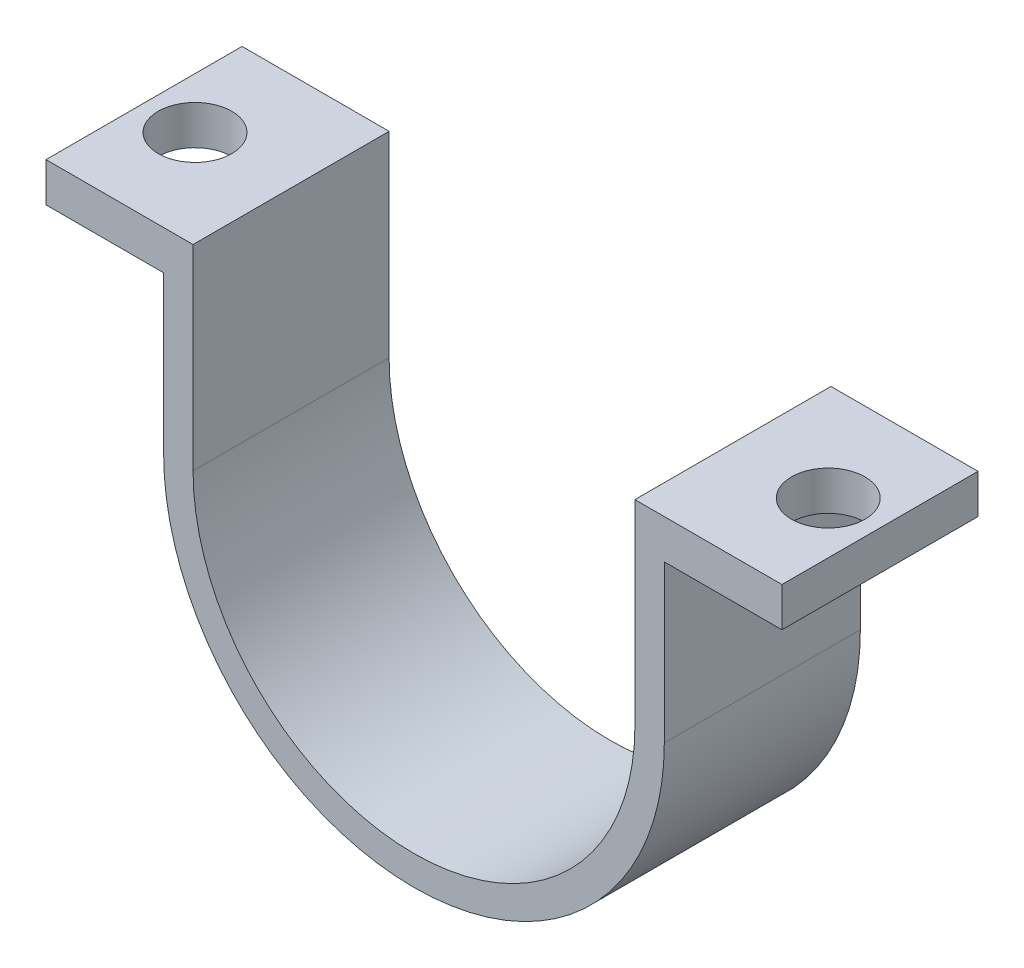
from build123d import *

# Parameters (mm, degrees)
BOSS_EXTRUDE2_DEPTH = 25.4
SKETCH5_R           = 4.7625
CUT_EXTRUDE1_DEPTH  = 38.1


with BuildPart() as part:
    # Sketch4 → Boss-Extrude2 (new body)
    with BuildSketch(Plane.XY):
        with BuildLine():
            Line((-32.385, 15.24), (-47.625, 15.24))
            Line((-47.625, 15.24), (-47.625, 20.32))
            Line((-47.625, 20.32), (-28.575, 20.32))
            Line((-28.575, 20.32), (-28.575, -5.08))
            ThreePointArc((-28.575, -5.08), (0.048187712, -33.703187712), (28.671375425, -5.08))
            Line((28.671375425, -5.08), (28.671375425, 20.32))
            Line((28.671375425, 20.32), (47.721375425, 20.32))
            Line((47.721375425, 20.32), (47.721375425, 15.24))
            Line((47.721375425, 15.24), (32.481375425, 15.24))
            Line((32.481375425, 15.24), (32.481375425, -5.08))
            ThreePointArc((32.481375425, -5.08), (0.048187712, -37.513187712), (-32.385, -5.08))
            Line((-32.385, -5.08), (-32.385, 15.24))
        make_face()
    extrude(amount=BOSS_EXTRUDE2_DEPTH)

    # Sketch5 → Cut-Extrude1 (cut)
    with BuildSketch(Plane(origin=(0, 20.32, 0), x_dir=(1, 0, 0), z_dir=(0, 1, 0))):
        with Locations(Location((-41.021, -12.7, 0), (0, 0, 180))):
            Circle(SKETCH5_R)
        with Locations(Location((41.021, -12.7, 0), (0, 0, 180))):
            Circle(SKETCH5_R)
    extrude(amount=-CUT_EXTRUDE1_DEPTH, mode=Mode.SUBTRACT)


solid = part.part
